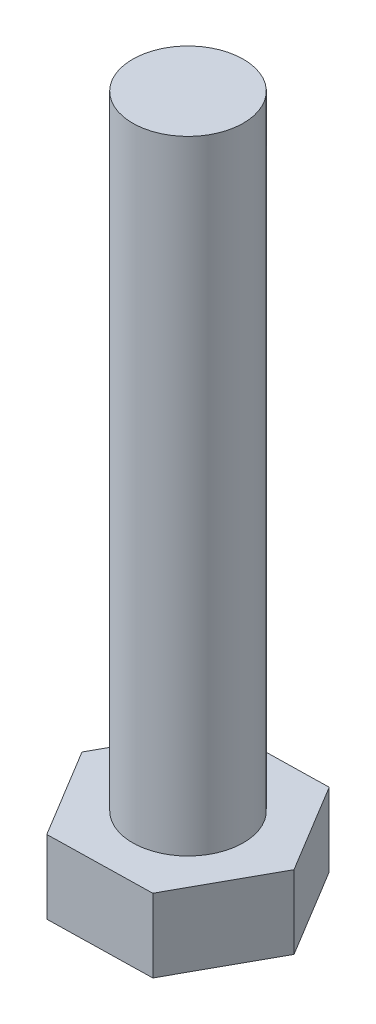
from build123d import *

# Parameters (mm, degrees)
BOSS_EXTRUDE1_DEPTH = 5.3
SKETCH2_R           = 4
BOSS_EXTRUDE2_DEPTH = 45


with BuildPart() as part:
    # Sketch1 → Boss-Extrude1 (new body)
    with BuildSketch(Plane(origin=(0, 0, 0), x_dir=(1, 0, 0), z_dir=(0, 1, 0))):
        Polygon((3.88351853, -6.422742184), (7.504017158, 0.151854611), (3.620498628, 6.574596795), (-3.88351853, 6.422742184), (-7.504017158, -0.151854611), (-3.620498628, -6.574596795), align=None)
    extrude(amount=BOSS_EXTRUDE1_DEPTH)

    # Sketch2 → Boss-Extrude2 (add)
    with BuildSketch(Plane(origin=(0, 5.3, 0), x_dir=(1, 0, 0), z_dir=(0, 1, 0))):
        with Locations(Location((0, 0, 0), (0, 0, 90))):
            Circle(SKETCH2_R)
    extrude(amount=BOSS_EXTRUDE2_DEPTH)


solid = part.part
